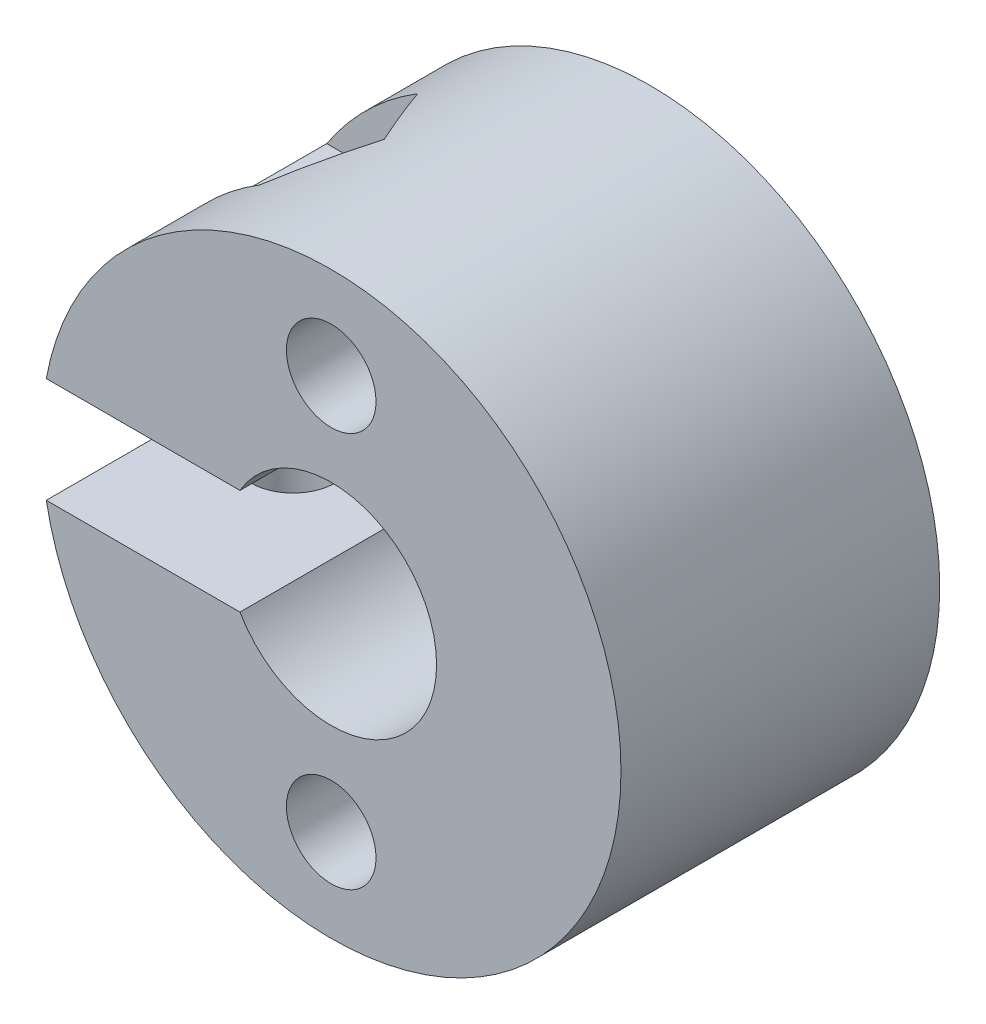
from build123d import *

# Parameters (mm, degrees)
EXTRUDE_1_DEPTH     = 6.05
SKETCH_3_R          = 1.6
CUT_EXTRUDE_1_DEPTH = 12.5
SKETCH_4_R          = 1.7
CUT_EXTRUDE_2_DEPTH = 25
SKETCH_5_R          = 3
CUT_EXTRUDE_3_DEPTH = 10
CUT_EXTRUDE_4_DEPTH = 10


with BuildPart() as part:
    # 草图1 → 凸台-拉伸1 (new, symmetric)
    with BuildSketch(Plane.XY):
        with BuildLine():
            ThreePointArc((-3.464101615, 2), (1.03527618, 3.863703305), (4, 0))
            Line((4, 0), (11, 0))
            ThreePointArc((11, 0), (1.004193186, 10.954067557), (-10.816653826, 2))
            Line((-10.816653826, 2), (-3.464101615, 2))
        make_face()
        with BuildLine():
            Line((11, 0), (4, 0))
            ThreePointArc((4, 0), (1.03527618, -3.863703305), (-3.464101615, -2))
            Line((-3.464101615, -2), (-10.816653826, -2))
            ThreePointArc((-10.816653826, -2), (1.004193186, -10.954067557), (11, 0))
        make_face()
    extrude(amount=EXTRUDE_1_DEPTH, both=True)

    # 草图3 → 切除-拉伸1 (cut, symmetric)
    with BuildSketch(Plane(origin=(0, 0, 0), x_dir=(1, 0, 0), z_dir=(0, 1, 0))):
        with Locations(Location((-7.5, 0, 0), (0, 0, 270))):
            Circle(SKETCH_3_R)
    extrude(amount=CUT_EXTRUDE_1_DEPTH, both=True, mode=Mode.SUBTRACT)

    # 草图4 → 切除-拉伸2 (cut)
    with BuildSketch(Plane(origin=(0, 0, -6.05), x_dir=(-1, 0, 0), z_dir=(0, 0, -1))):
        with Locations((0, 7.5)):
            Circle(SKETCH_4_R)
        with Locations((0, -7.5)):
            Circle(SKETCH_4_R)
    extrude(amount=-CUT_EXTRUDE_2_DEPTH, mode=Mode.SUBTRACT)

    # 草图5 → 切除-拉伸3 (cut)
    with BuildSketch(Plane(origin=(0, -6, 0), x_dir=(-1, 0, 0), z_dir=(0, -1, 0))):
        with Locations((7.5, 0)):
            Circle(SKETCH_5_R)
    extrude(amount=CUT_EXTRUDE_3_DEPTH, mode=Mode.SUBTRACT)

    # 草图6 → 切除-拉伸4 (cut)
    with BuildSketch(Plane(origin=(0, 6, 0), x_dir=(-1, 0, 0), z_dir=(0, -1, 0))):
        Polygon((10.964101615, 0), (9.232050808, 3), (5.767949192, 3), (4.035898385, 0), (5.767949192, -3), (9.232050808, -3), align=None)
    extrude(amount=-CUT_EXTRUDE_4_DEPTH, mode=Mode.SUBTRACT)


solid = part.part
